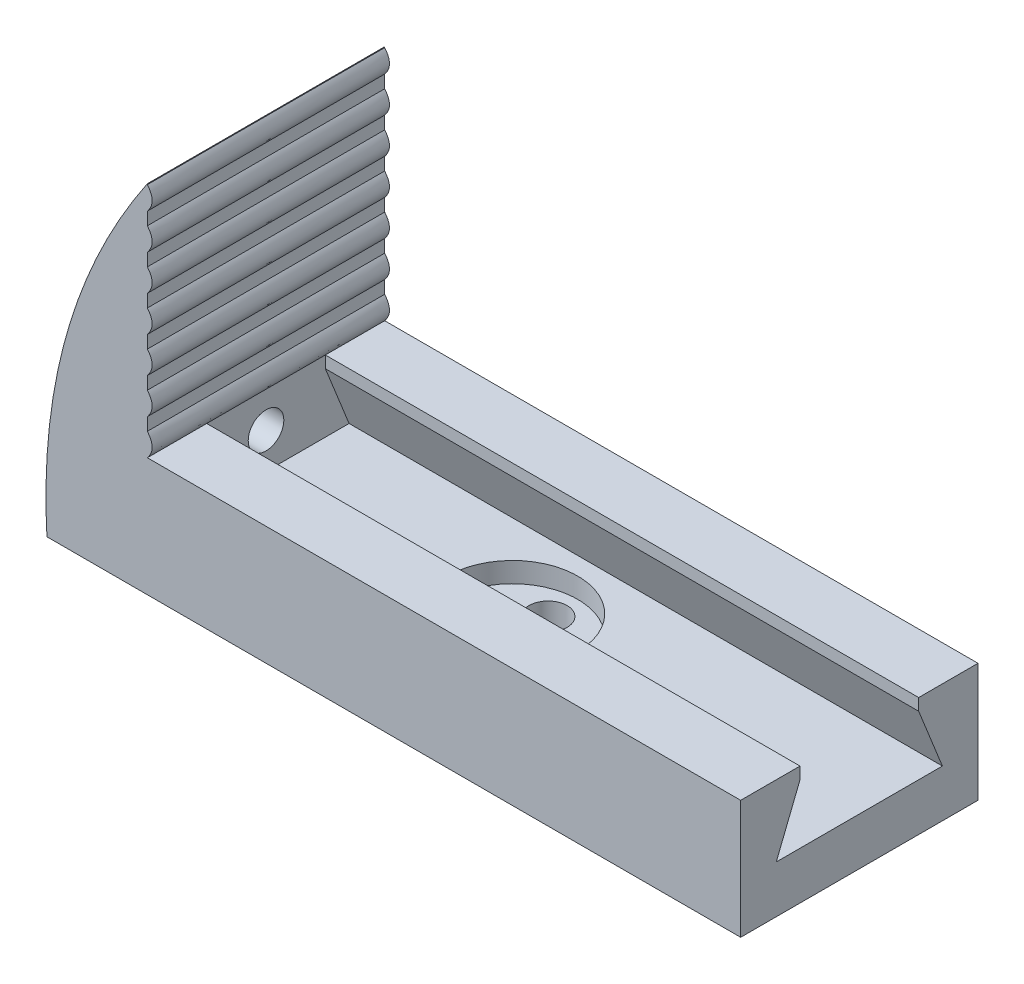
from build123d import *

# Parameters (mm, degrees)
SKETCH_1_W               = 50
SKETCH_1_H               = 20
EXTRUDE_1_DEPTH          = 10
CUT_EXTRUDE_1_DEPTH      = 57
CUT_EXTRUDE_2_DEPTH      = 57
EXTRUDE_2_DEPTH          = 20
EXTRUDE_3_DEPTH          = 20
CUT_EXTRUDE_3_DEPTH      = 3
CUT_EXTRUDE_3_DEPTH_BACK = 16
SKETCH_7_R               = 1.5
SKETCH_12_R              = 1.6
CUT_EXTRUDE_4_DEPTH      = 13
SKETCH_13_R              = 5.5
CUT_EXTRUDE_6_DEPTH      = 1.7


with BuildPart() as part:
    # 草图1 → 凸台-拉伸1 (new body)
    with BuildSketch(Plane(origin=(0, 0, 0), x_dir=(1, 0, 0), z_dir=(0, 1, 0))):
        Rectangle(SKETCH_1_W, SKETCH_1_H)
    extrude(amount=EXTRUDE_1_DEPTH)

    # 草图2 → 切除-拉伸1 (cut)
    with BuildSketch(Plane.ZY.offset(25)):
        Polygon((7, 4), (-7, 4), (-5, 9), (5, 9), align=None)
    extrude(amount=-CUT_EXTRUDE_1_DEPTH, mode=Mode.SUBTRACT)

    # 草图3 → 切除-拉伸2 (cut)
    with BuildSketch(Plane.ZY.offset(25)):
        Polygon((-5, 9), (-5, 16.661524688), (-5, 24.510715087), (5, 24.510715087), (5, 9), align=None)
    extrude(amount=-CUT_EXTRUDE_2_DEPTH, mode=Mode.SUBTRACT)

    # 草图5 → 凸台-拉伸2 (add)
    with BuildSketch(Plane.XY.offset(10)):
        with BuildLine():
            Line((-25, 0), (-25, 30))
            add(Edge.make_bspline(
                [(-25, 30), (-34.394309347, 16.149944275), (-33.463121006, 0)],
                knots=[0, 0, 0, 1, 1, 1], degree=2))
            Line((-33.463121006, 0), (-25, 0))
        make_face()
    extrude(amount=-EXTRUDE_2_DEPTH)

    # 草图6 → 凸台-拉伸3 (add)
    with BuildSketch(Plane(origin=(0, 0, -10), x_dir=(-1, 0, 0), z_dir=(0, 0, -1))):
        with BuildLine():
            Line((25, 11.927521415), (25, 10))
            add(Edge.make_bspline(
                [(25, 10), (24.19442895, 10.965387518), (25, 11.927521415)],
                knots=[0, 0, 0, 1, 1, 1], degree=2))
        make_face()
        with BuildLine():
            Line((25, 14.927521415), (25, 13))
            add(Edge.make_bspline(
                [(25, 13), (24.19442895, 13.965387518), (25, 14.927521415)],
                knots=[0, 0, 0, 1, 1, 1], degree=2))
        make_face()
        with BuildLine():
            Line((25, 17.927521415), (25, 16))
            add(Edge.make_bspline(
                [(25, 16), (24.19442895, 16.965387518), (25, 17.927521415)],
                knots=[0, 0, 0, 1, 1, 1], degree=2))
        make_face()
        with BuildLine():
            Line((25, 20.927521415), (25, 19))
            add(Edge.make_bspline(
                [(25, 19), (24.19442895, 19.965387518), (25, 20.927521415)],
                knots=[0, 0, 0, 1, 1, 1], degree=2))
        make_face()
        with BuildLine():
            Line((25, 23.927521415), (25, 22))
            add(Edge.make_bspline(
                [(25, 22), (24.19442895, 22.965387518), (25, 23.927521415)],
                knots=[0, 0, 0, 1, 1, 1], degree=2))
        make_face()
        with BuildLine():
            Line((25, 26.927521415), (25, 25))
            add(Edge.make_bspline(
                [(25, 25), (24.19442895, 25.965387518), (25, 26.927521415)],
                knots=[0, 0, 0, 1, 1, 1], degree=2))
        make_face()
        with BuildLine():
            Line((25, 29.927521415), (25, 28))
            add(Edge.make_bspline(
                [(25, 28), (24.19442895, 28.965387518), (25, 29.927521415)],
                knots=[0, 0, 0, 1, 1, 1], degree=2))
        make_face()
    extrude(amount=-EXTRUDE_3_DEPTH)

    # 草图7 → 切除-拉伸3 (cut, two sides: drawn at the far end of the back side and taken through both)
    with BuildSketch(Plane(origin=(-25, 0, 0), x_dir=(0, 0, -1), z_dir=(1, 0, 0)).offset(-CUT_EXTRUDE_3_DEPTH_BACK)):
        with Locations(Location((0, 7, 0), (0, 0, 180))):
            Circle(SKETCH_7_R)
    extrude(amount=CUT_EXTRUDE_3_DEPTH + CUT_EXTRUDE_3_DEPTH_BACK, mode=Mode.SUBTRACT)

    # 草图12 → 切除-拉伸4 (cut)
    with BuildSketch(Plane.XZ):
        with Locations(Location((-4.231560503, 3, 0), (0, 0, 270))):
            Circle(SKETCH_12_R)
        with Locations(Location((-4.231560503, -3, 0), (0, 0, 270))):
            Circle(SKETCH_12_R)
        with Locations(Location((-1.231560503, 0, 0), (0, 0, 270))):
            Circle(SKETCH_12_R)
        with Locations(Location((-7.231560503, 0, 0), (0, 0, 270))):
            Circle(SKETCH_12_R)
    extrude(amount=-CUT_EXTRUDE_4_DEPTH, mode=Mode.SUBTRACT)

    # 草图13 → 切除-拉伸6 (cut)
    with BuildSketch(Plane(origin=(0, 4, 0), x_dir=(1, 0, 0), z_dir=(0, 1, 0))):
        with Locations(Location((-4.231560503, 0, 0), (0, 0, 270))):
            Circle(SKETCH_13_R)
    extrude(amount=-CUT_EXTRUDE_6_DEPTH, mode=Mode.SUBTRACT)


solid = part.part
